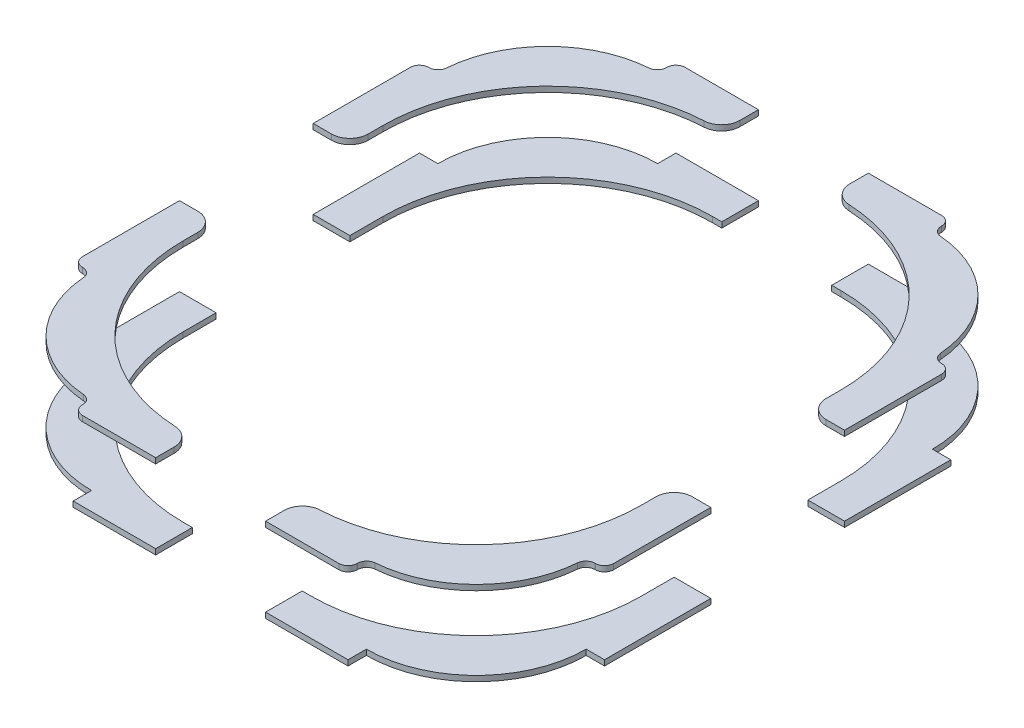
from build123d import *

# Parameters (mm, degrees)
BOSS_EXTRUDE1_DEPTH   = 3
BOSS_EXTRUDE1_2_DEPTH = 3
BOSS_EXTRUDE1_3_DEPTH = 3
BOSS_EXTRUDE1_4_DEPTH = 3
FILLET6_R             = 10
FILLET7_R             = 10
FILLET8_R             = 10
FILLET9_R             = 10
FILLET10_R            = 5
FILLET11_R            = 5
FILLET12_R            = 5
FILLET13_R            = 5
LPATTERN1_COUNT       = 2
LPATTERN1_PITCH       = 43


with BuildPart() as part:
    # Sketch1 → Boss-Extrude1 (new body)
    with BuildSketch(Plane(origin=(0, 0, 0), x_dir=(1, 0, 0), z_dir=(0, 1, 0))):
        with BuildLine():
            Line((0, 10), (0, -10))
            Line((0, -10), (-45, -10))
            Line((-45, -10), (-45, 0))
            ThreePointArc((-45, 0), (-87.426406871, 17.573593129), (-105, 60))
            Line((-105, 60), (-115, 60))
            Line((-115, 60), (-115, 118))
            Line((-115, 118), (-95, 118))
            Line((-95, 118), (-95, 100))
            ThreePointArc((-95, 100), (-68.639610307, 36.360389693), (-5, 10))
            Line((-5, 10), (0, 10))
        make_face()
    boss_extrude1 = extrude(amount=BOSS_EXTRUDE1_DEPTH)

    # Fillet7
    fillet7_edges = [part.edges().sort_by_distance(p)[0] for p in [
        (0, 1.5, -10),
        (-95, 1.5, -118),
    ]]
    fillet(fillet7_edges, radius=FILLET7_R)

    # Fillet13
    fillet13_edges = [part.edges().sort_by_distance(p)[0] for p in [
        (-45, 1.5, 10),
        (-45, 1.5, 0),
        (-105, 1.5, -60),
        (-115, 1.5, -60),
    ]]
    fillet(fillet13_edges, radius=FILLET13_R)


with BuildPart() as body_2:
    # Sketch1 → Boss-Extrude1 2 (new body)
    with BuildSketch(Plane(origin=(0, 0, 0), x_dir=(1, 0, 0), z_dir=(0, 1, 0))):
        with BuildLine():
            Line((0, 299), (-5, 299))
            ThreePointArc((-5, 299), (-68.639610307, 272.639610307), (-95, 209))
            Line((-95, 209), (-95, 191))
            Line((-95, 191), (-115, 191))
            Line((-115, 191), (-115, 249))
            Line((-115, 249), (-105, 249))
            ThreePointArc((-105, 249), (-87.426406871, 291.426406871), (-45, 309))
            Line((-45, 309), (-45, 319))
            Line((-45, 319), (0, 319))
            Line((0, 319), (0, 299))
        make_face()
    boss_extrude1_2 = extrude(amount=BOSS_EXTRUDE1_2_DEPTH)

    # Fillet8
    fillet8_edges = [body_2.edges().sort_by_distance(p)[0] for p in [
        (0, 1.5, -299),
        (-95, 1.5, -191),
    ]]
    fillet(fillet8_edges, radius=FILLET8_R)

    # Fillet10
    fillet10_edges = [body_2.edges().sort_by_distance(p)[0] for p in [
        (-115, 1.5, -249),
        (-105, 1.5, -249),
        (-45, 1.5, -309),
        (-45, 1.5, -319),
    ]]
    fillet(fillet10_edges, radius=FILLET10_R)


with BuildPart() as body_3:
    # Sketch1 → Boss-Extrude1 3 (new body)
    with BuildSketch(Plane(origin=(0, 0, 0), x_dir=(1, 0, 0), z_dir=(0, 1, 0))):
        with BuildLine():
            Line((60, 299), (60, 319))
            Line((60, 319), (105, 319))
            Line((105, 319), (105, 309))
            ThreePointArc((105, 309), (147.426406871, 291.426406871), (165, 249))
            Line((165, 249), (175, 249))
            Line((175, 249), (175, 191))
            Line((175, 191), (155, 191))
            Line((155, 191), (155, 209))
            ThreePointArc((155, 209), (128.639610307, 272.639610307), (65, 299))
            Line((65, 299), (60, 299))
        make_face()
    boss_extrude1_3 = extrude(amount=BOSS_EXTRUDE1_3_DEPTH)

    # Fillet9
    fillet9_edges = [body_3.edges().sort_by_distance(p)[0] for p in [
        (155, 1.5, -191),
        (60, 1.5, -299),
    ]]
    fillet(fillet9_edges, radius=FILLET9_R)

    # Fillet11
    fillet11_edges = [body_3.edges().sort_by_distance(p)[0] for p in [
        (165, 1.5, -249),
        (175, 1.5, -249),
        (105, 1.5, -319),
        (105, 1.5, -309),
    ]]
    fillet(fillet11_edges, radius=FILLET11_R)


with BuildPart() as body_4:
    # Sketch1 → Boss-Extrude1 4 (new body)
    with BuildSketch(Plane(origin=(0, 0, 0), x_dir=(1, 0, 0), z_dir=(0, 1, 0))):
        with BuildLine():
            Line((60, 10), (65, 10))
            ThreePointArc((65, 10), (128.639610307, 36.360389693), (155, 100))
            Line((155, 100), (155, 118))
            Line((155, 118), (175, 118))
            Line((175, 118), (175, 60))
            Line((175, 60), (165, 60))
            ThreePointArc((165, 60), (147.426406871, 17.573593129), (105, 0))
            Line((105, 0), (105, -10))
            Line((105, -10), (60, -10))
            Line((60, -10), (60, 10))
        make_face()
    boss_extrude1_4 = extrude(amount=BOSS_EXTRUDE1_4_DEPTH)

    # Fillet6
    fillet6_edges = [body_4.edges().sort_by_distance(p)[0] for p in [
        (60, 1.5, -10),
        (155, 1.5, -118),
    ]]
    fillet(fillet6_edges, radius=FILLET6_R)

    # Fillet12
    fillet12_edges = [body_4.edges().sort_by_distance(p)[0] for p in [
        (175, 1.5, -60),
        (165, 1.5, -60),
        (105, 1.5, 0),
        (105, 1.5, 10),
    ]]
    fillet(fillet12_edges, radius=FILLET12_R)


with BuildPart() as lpattern1_1:
    # LPattern1: Boss-Extrude1, Boss-Extrude1 2, Boss-Extrude1 3, Boss-Extrude1 4 ×2
    with Locations(*[(0, -i * LPATTERN1_PITCH, 0) for i in range(1, LPATTERN1_COUNT)]):
        add(boss_extrude1)
        add(boss_extrude1_2)
        add(boss_extrude1_3)
        add(boss_extrude1_4)


solid = Compound([part.part, body_2.part, body_3.part, body_4.part, lpattern1_1.part])
